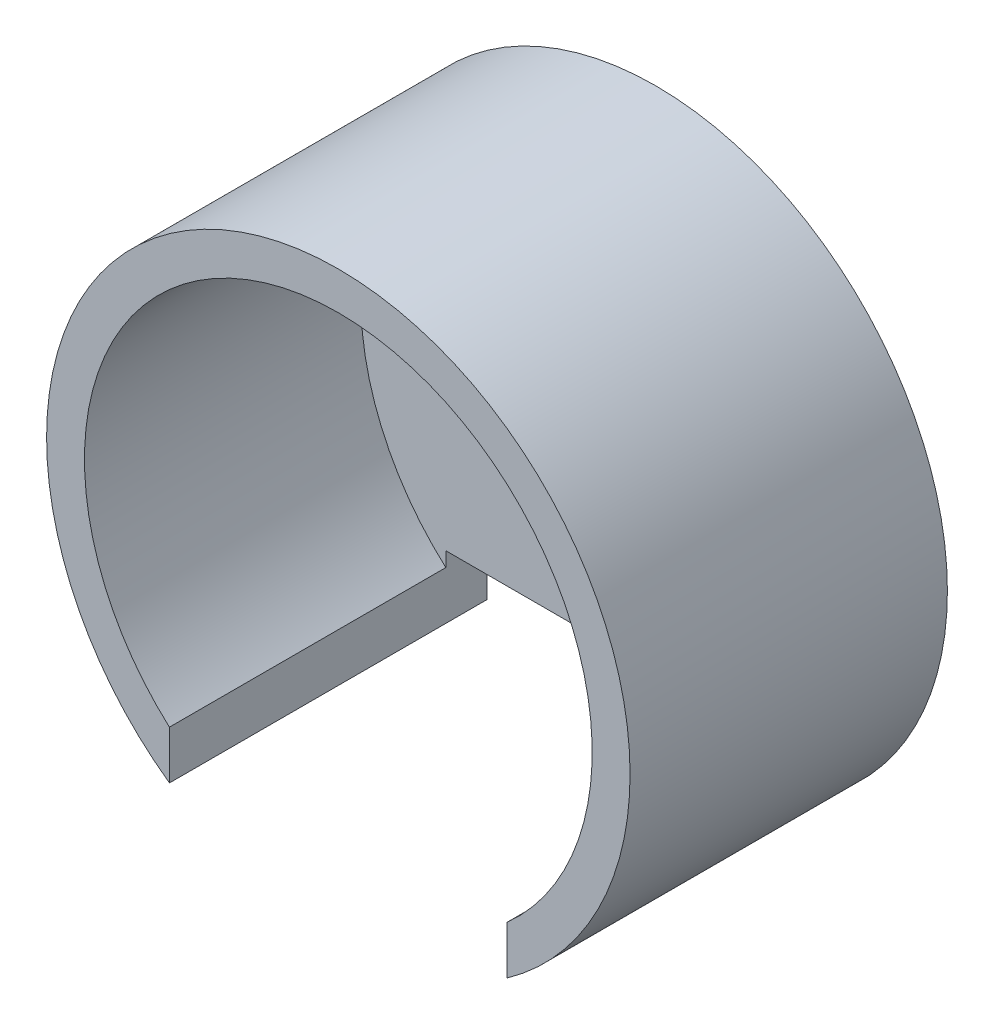
from build123d import *

# Parameters (mm, degrees)
SKETCH_1_R          = 14.25
SKETCH_1_R_2        = 12.4
EXTRUDE_1_DEPTH     = 13.5
EXTRUDE_START       = 2
SKETCH_2_R          = 14.25
SKETCH_2_R_2        = 4.5
SKETCH_2_R_3        = 1.5
EXTRUDE_2_DEPTH     = 2
SKETCH_4_W          = 16.5
SKETCH_4_H          = 7.711801842
CUT_EXTRUDE_2_DEPTH = 19


with BuildPart() as part:
    # 草图1 → 凸台-拉伸1 (new body)
    with BuildSketch(Plane.XY):
        Circle(SKETCH_1_R)
        Circle(SKETCH_1_R_2, mode=Mode.SUBTRACT)
    extrude(amount=EXTRUDE_1_DEPTH)

    # 草图2 → 凸台-拉伸2 (add)
    with BuildSketch(Plane(origin=(0, 0, 0), x_dir=(-1, 0, 0), z_dir=(0, 0, -1)).offset(EXTRUDE_START)):
        Circle(SKETCH_2_R)
        Circle(SKETCH_2_R_2, mode=Mode.SUBTRACT)
        with Locations((-10, 0)):
            Circle(SKETCH_2_R_3, mode=Mode.SUBTRACT)
    extrude(amount=-EXTRUDE_2_DEPTH)

    # 草图4 → 切除-拉伸2 (cut)
    with BuildSketch(Plane.XY.offset(13.5)):
        with Locations((0, -12.4)):
            Rectangle(SKETCH_4_W, SKETCH_4_H)
    extrude(amount=-CUT_EXTRUDE_2_DEPTH, mode=Mode.SUBTRACT)


solid = part.part
